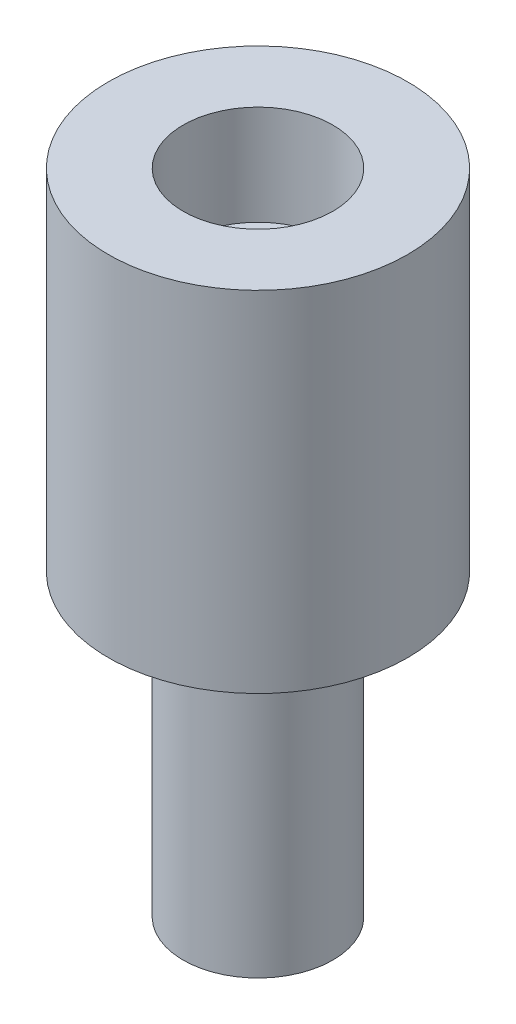
from build123d import *


with BuildPart() as part:
    # Sketch1 → Revolve1 (revolve)
    with BuildSketch(Plane.XY, mode=Mode.PRIVATE) as revolve1_sk:
        Polygon((0, 11), (-1.5, 11), (-1.5, 13), (-3, 13), (-3, 6), (-1.5, 6), (-1.5, 0), (0, 0), align=None)
    revolve(revolve1_sk.sketch.rotate(Axis((0, 0, 0), (0, 1, 0)), 180), axis=Axis((0, 0, 0), (0, 1, 0)))


solid = part.part
